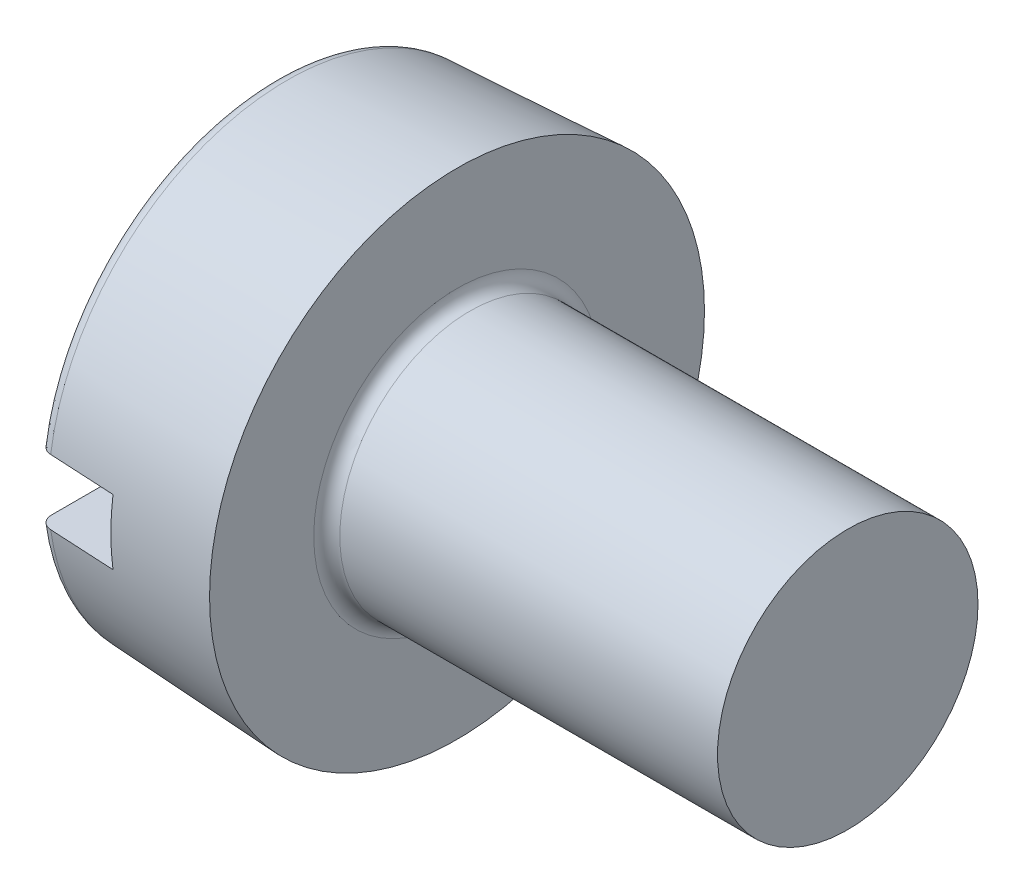
from build123d import *

# Parameters (mm, degrees)
SKETCH2_R       = 1.9
BASEHEAD_DEPTH  = 1.4
BASEHEAD_DRAFT  = -3
SKETCH3_R       = 1
BASEBODY_DEPTH  = 3
SLOT_DEPTH      = 8.598684097
SLOT_DEPTH_BACK = 8.598684097
SKETCH4_W       = 0.5
SKETCH4_H       = 0.6
HEADFILLET_R    = 0.1


with BuildPart() as part:
    # Sketch2 → BaseHead (with draft: the straight prism first)
    with BuildSketch(Plane(origin=(1.4, 0, 0), x_dir=(0, 0, -1), z_dir=(1, 0, 0))):
        Circle(SKETCH2_R)
    extrude(amount=-BASEHEAD_DEPTH)
    # BaseHead: the draft: its side faces are tilted about the plane it starts from
    basehead_sides = [part.faces().sort_by_distance(p)[0] for p in [
        (0.7, 0, 1.9),
    ]]
    draft(basehead_sides, Plane(origin=(1.4, 0, 0), x_dir=(0, 0, -1), z_dir=(1, 0, 0)), BASEHEAD_DRAFT)

    # Sketch3 → BaseBody (add)
    with BuildSketch(Plane(origin=(1.4, -1.110095321, -1.354392991), x_dir=(0, 0, -1), z_dir=(1, 0, 0))):
        with Locations((-1.354392991, 1.110095321)):
            Circle(SKETCH3_R)
    extrude(amount=BASEBODY_DEPTH)

    # Sketch4 → Slot (cut, two sides: drawn at the far end of the back side and taken through both)
    with BuildSketch(Plane(origin=(-1.9, -1.9, 0), x_dir=(0, 1, 0), z_dir=(0, 0, 1)).offset(-SLOT_DEPTH_BACK)):
        with Locations((1.9, -2.2)):
            Rectangle(SKETCH4_W, SKETCH4_H)
    extrude(amount=SLOT_DEPTH + SLOT_DEPTH_BACK, mode=Mode.SUBTRACT)

    # HeadFillet
    headfillet_edges = [part.edges().sort_by_distance(p)[0] for p in [
        (1.4, 0, 1),
        (0, -1.826629109, 0),
        (0, 1.826629109, 0),
    ]]
    fillet(headfillet_edges, radius=HEADFILLET_R)


solid = part.part
